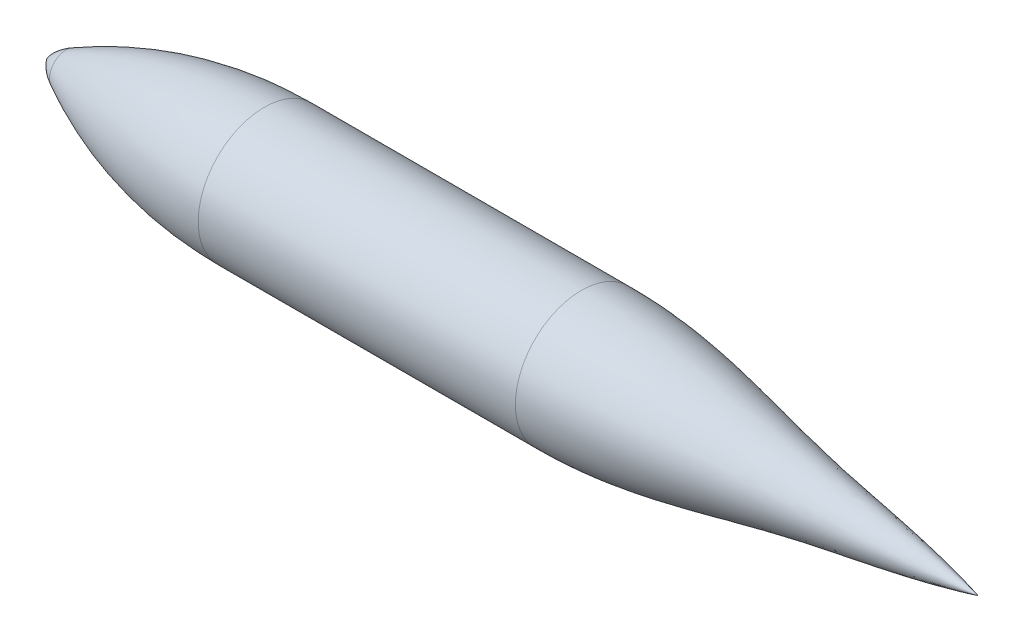
from build123d import *


with BuildPart() as part:
    # Schizzo6 → Rivoluzione1 (revolve)
    with BuildSketch(Plane(origin=(0, 0, 0), x_dir=(-1, 0, 0), z_dir=(0, 1, 0)), mode=Mode.PRIVATE) as rivoluzione1_sk:
        with BuildLine():
            Line((312.8, 28.97), (173.8, 28.97))
            add(Edge.make_bspline(
                [(0, 0), (25.189681618, 6.751630026), (65.524514327, 11.077875163), (123.601815916, 24.778959704), (154.27405796, 28.97), (173.8, 28.97)],
                knots=[0, 0, 0, 0, 0.440523165, 0.694819662, 1, 1, 1, 1], degree=3))
            Line((0, 0), (407.984249418, 0))
            add(Edge.make_bspline(
                [(399.7, 7.24), (404.778087213, 4.684735831), (407.984249418, 0)],
                knots=[0, 0, 0, 1, 1, 1], degree=2))
            add(Edge.make_bspline(
                [(312.8, 28.97), (358.928969374, 28.778638575), (399.7, 7.24)],
                knots=[0, 0, 0, 1, 1, 1], degree=2))
        make_face()
    revolve(rivoluzione1_sk.sketch.rotate(Axis((0, 0, 0), (-1, 0, 0)), 180), axis=Axis((0, 0, 0), (-1, 0, 0)))


solid = part.part
